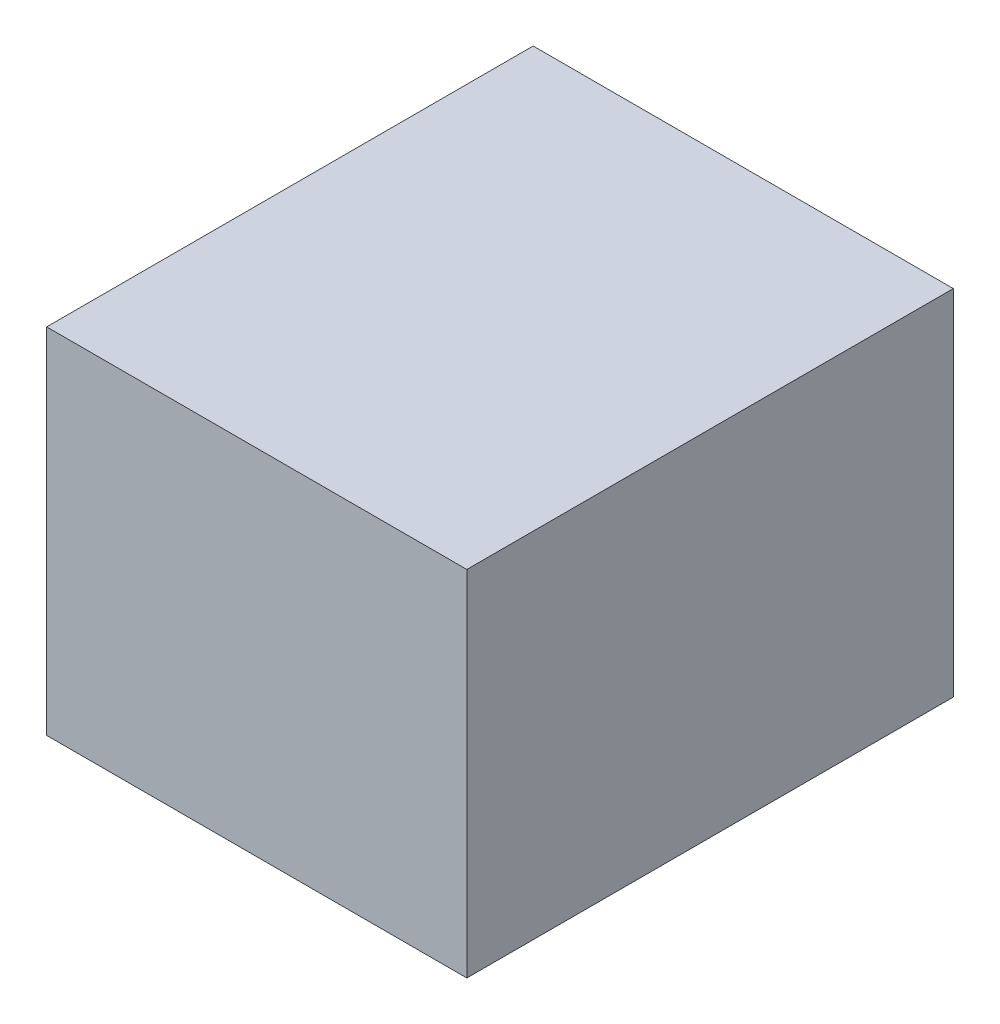
from build123d import *

# Parameters (mm, degrees)
SKETCH2_W           = 38
SKETCH2_H           = 44
BOSS_EXTRUDE1_DEPTH = 32


with BuildPart() as part:
    # Sketch2 → Boss-Extrude1 (new body)
    with BuildSketch(Plane(origin=(0, 0, 0), x_dir=(1, 0, 0), z_dir=(0, 1, 0))):
        Rectangle(SKETCH2_W, SKETCH2_H)
    extrude(amount=BOSS_EXTRUDE1_DEPTH)


solid = part.part
